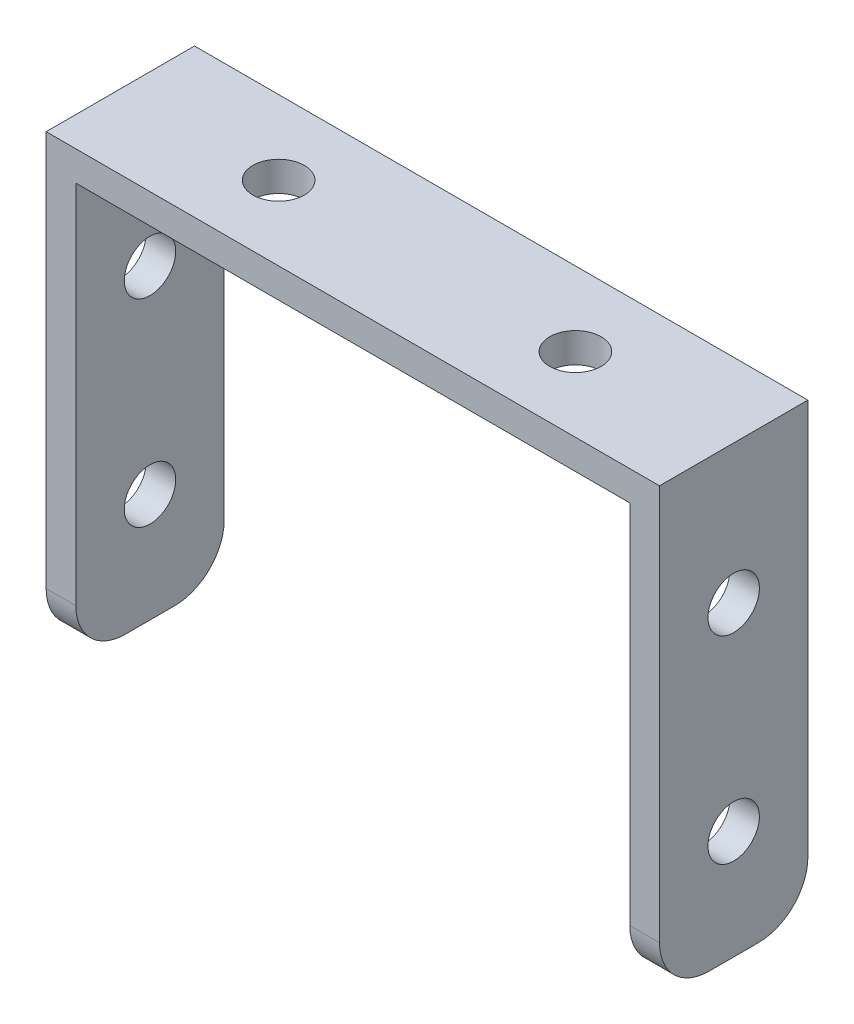
from build123d import *

# Parameters (mm, degrees)
RESSALTO_EXTRUS_O1_DEPTH = 15
ESBO_O2_R                = 2.6
CORTE_EXTRUS_O1_DEPTH    = 15
ESBO_O3_R                = 2.6
CORTE_EXTRUS_O2_DEPTH    = 79.064076245
FILETE1_R                = 5


with BuildPart() as part:
    # Esboço1 → Ressalto-extrusão1 (new body)
    with BuildSketch(Plane.XY):
        Polygon((-31, 0), (-28, 0), (-28, 42), (28, 42), (28, 0), (31, 0), (31, 45), (-31, 45), align=None)
    extrude(amount=RESSALTO_EXTRUS_O1_DEPTH)

    # Esboço2 → Corte-extrusão1 (cut)
    with BuildSketch(Plane(origin=(0, 45, 0), x_dir=(1, 0, 0), z_dir=(0, 1, 0))):
        with Locations(Location((-15, -7.5, 0), (0, 0, 270))):
            Circle(ESBO_O2_R)
        with Locations(Location((15, -7.5, 0), (0, 0, 270))):
            Circle(ESBO_O2_R)
    extrude(amount=-CORTE_EXTRUS_O1_DEPTH, mode=Mode.SUBTRACT)

    # Esboço3 → Corte-extrusão2 (cut, through all)
    with BuildSketch(Plane(origin=(31, 0, 0), x_dir=(0, 0, -1), z_dir=(1, 0, 0))):
        with Locations((-7.5, 11)):
            Circle(ESBO_O3_R)
        with Locations((-7.5, 31)):
            Circle(ESBO_O3_R)
    extrude(amount=-CORTE_EXTRUS_O2_DEPTH, mode=Mode.SUBTRACT)

    # Filete1
    filete1_edges = [part.edges().sort_by_distance(p)[0] for p in [
        (-29.5, 0, 0),
        (29.5, 0, 15),
        (-29.5, 0, 15),
        (29.5, 0, 0),
    ]]
    fillet(filete1_edges, radius=FILETE1_R)


solid = part.part
